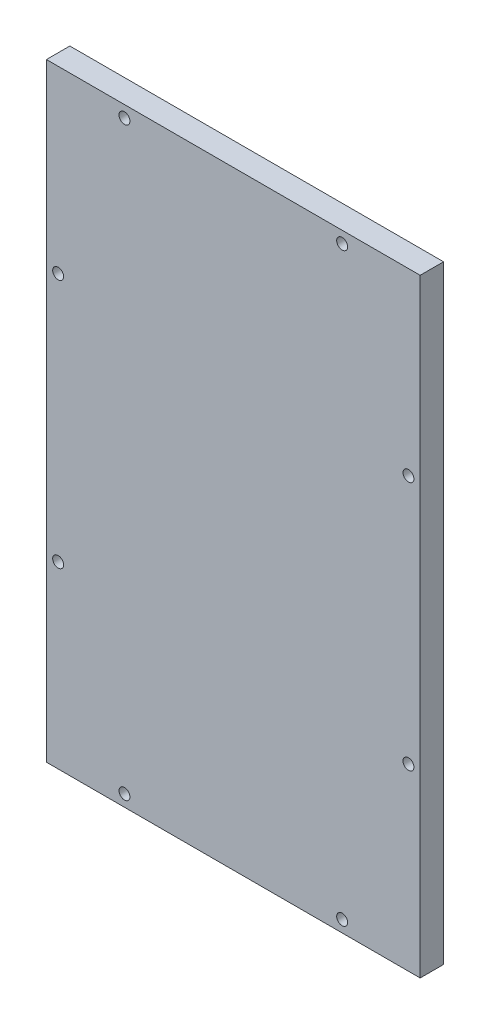
from build123d import *

# Parameters (mm, degrees)
SKETCH_1_W          = 47.9
SKETCH_1_H          = 78
EXTRUDE_1_DEPTH     = 3
SKETCH_2_R          = 0.7
CUT_EXTRUDE_1_DEPTH = 46.865046604
SKETCH_2_3_R        = 1
CUT_EXTRUDE_2_DEPTH = 1.5


with BuildPart() as part:
    # 草图1 → 凸台-拉伸1 (new body)
    with BuildSketch(Plane.XY):
        Rectangle(SKETCH_1_W, SKETCH_1_H)
    extrude(amount=EXTRUDE_1_DEPTH)

    # 草图2 → 切除-拉伸1 (cut, through all)
    with BuildSketch(Plane(origin=(0, 0, 0), x_dir=(-1, 0, 0), z_dir=(0, 0, -1))):
        with Locations((-13.95, 37.5)):
            Circle(SKETCH_2_R)
        with Locations((13.95, 37.5)):
            Circle(SKETCH_2_R)
        with Locations((-13.95, -37.5)):
            Circle(SKETCH_2_R)
        with Locations((13.95, -37.5)):
            Circle(SKETCH_2_R)
        with Locations((-22.45, 16)):
            Circle(SKETCH_2_R)
        with Locations((-22.45, -16)):
            Circle(SKETCH_2_R)
        with Locations((22.45, 16)):
            Circle(SKETCH_2_R)
        with Locations((22.45, -16)):
            Circle(SKETCH_2_R)
    extrude(amount=-CUT_EXTRUDE_1_DEPTH, mode=Mode.SUBTRACT)

    # 草图2<3> → 切除-拉伸2 (cut)
    with BuildSketch(Plane(origin=(0, 0, 0), x_dir=(-1, 0, 0), z_dir=(0, 0, -1))):
        with Locations((-13.95, 37.5)):
            Circle(SKETCH_2_3_R)
        with Locations((13.95, 37.5)):
            Circle(SKETCH_2_3_R)
        with Locations((-13.95, -37.5)):
            Circle(SKETCH_2_3_R)
        with Locations((13.95, -37.5)):
            Circle(SKETCH_2_3_R)
        with Locations((-22.45, 16)):
            Circle(SKETCH_2_3_R)
        with Locations((22.45, 16)):
            Circle(SKETCH_2_3_R)
        with Locations((-22.45, -16)):
            Circle(SKETCH_2_3_R)
        with Locations((22.45, -16)):
            Circle(SKETCH_2_3_R)
    extrude(amount=-CUT_EXTRUDE_2_DEPTH, mode=Mode.SUBTRACT)


solid = part.part
